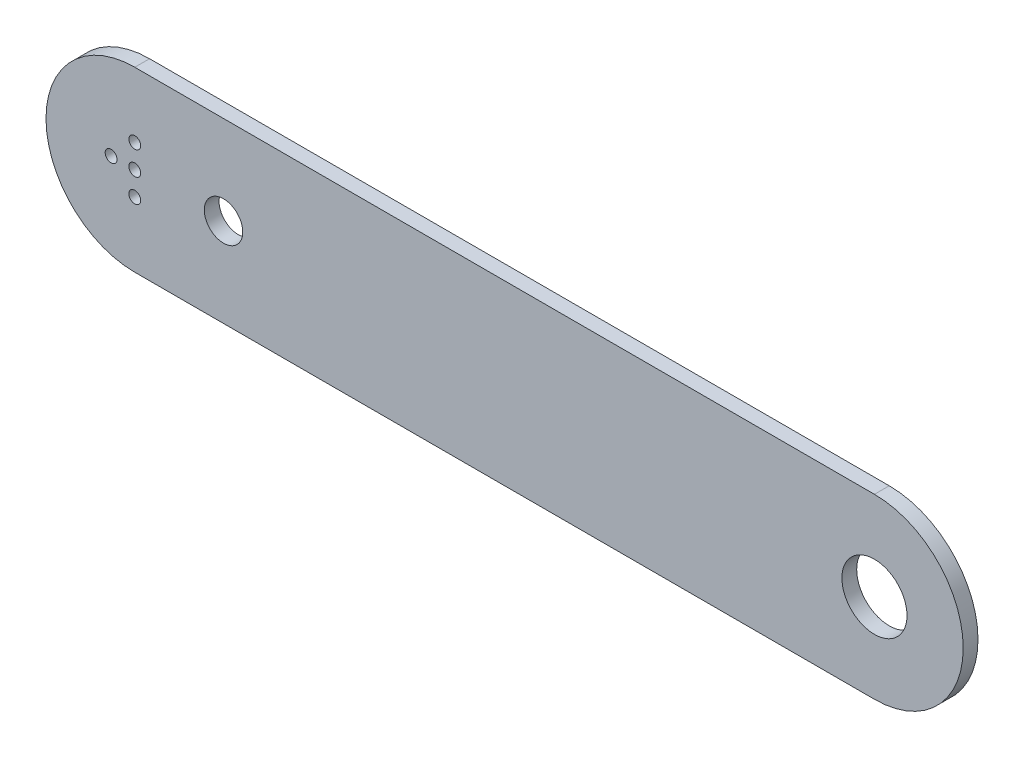
from build123d import *

# Parameters (mm, degrees)
SALIENTE_EXTRUIR1_DEPTH = 5
CROQUIS2_R              = 11
CROQUIS2_R_2            = 6.5
CROQUIS2_R_3            = 2
CORTAR_EXTRUIR4_DEPTH   = 220


with BuildPart() as part:
    # Croquis1 → Saliente-Extruir1 (new body)
    with BuildSketch(Plane.XY):
        with BuildLine():
            Line((120, 0), (370, 0))
            ThreePointArc((370, 0), (400, 30), (370, 60))
            Line((370, 60), (120, 60))
            ThreePointArc((120, 60), (90, 30), (120, 0))
        make_face()
    extrude(amount=SALIENTE_EXTRUIR1_DEPTH)

    # Croquis2 → Cortar-Extruir4 (cut)
    with BuildSketch(Plane.XY.offset(5)):
        with Locations((370, 30)):
            Circle(CROQUIS2_R)
        with Locations((150, 30)):
            Circle(CROQUIS2_R_2)
        with Locations((120, 30)):
            Circle(CROQUIS2_R_3)
        with Locations((120, 22)):
            Circle(CROQUIS2_R_3)
        with Locations((120, 38)):
            Circle(CROQUIS2_R_3)
        with Locations((112, 30)):
            Circle(CROQUIS2_R_3)
    extrude(amount=-CORTAR_EXTRUIR4_DEPTH, mode=Mode.SUBTRACT)


solid = part.part
